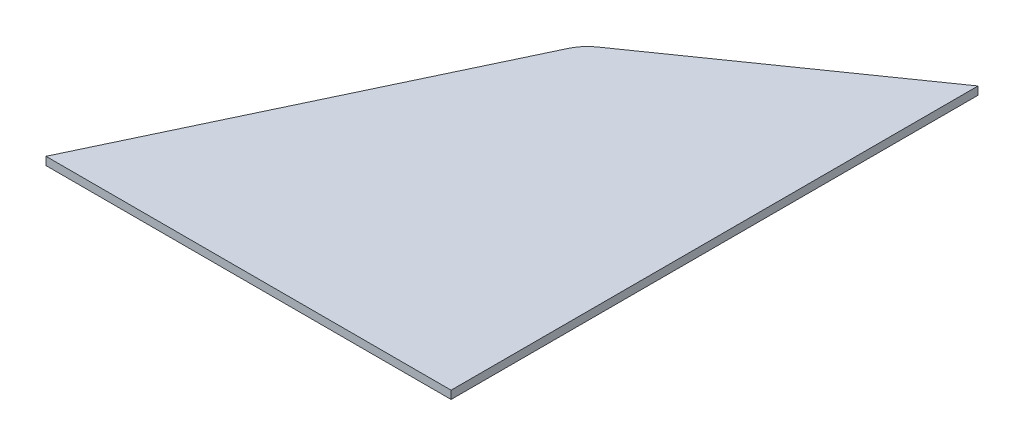
from build123d import *

# Parameters (mm, degrees)
RESSALTO_EXTRUS_O1_DEPTH = 2
FILETE1_R                = 10


with BuildPart() as part:
    # Esboço1 → Ressalto-extrusão1 (new body)
    with BuildSketch(Plane(origin=(0, 0, 0), x_dir=(1, 0, 0), z_dir=(0, 1, 0))):
        Polygon((0, 0), (100.1, 0), (100.1, 130.2), (42.5645027, 90), align=None)
    extrude(amount=RESSALTO_EXTRUS_O1_DEPTH)

    # Filete1
    filete1_edges = [part.edges().sort_by_distance(p)[0] for p in [
        (42.5645027, 1, -90),
    ]]
    fillet(filete1_edges, radius=FILETE1_R)


solid = part.part
